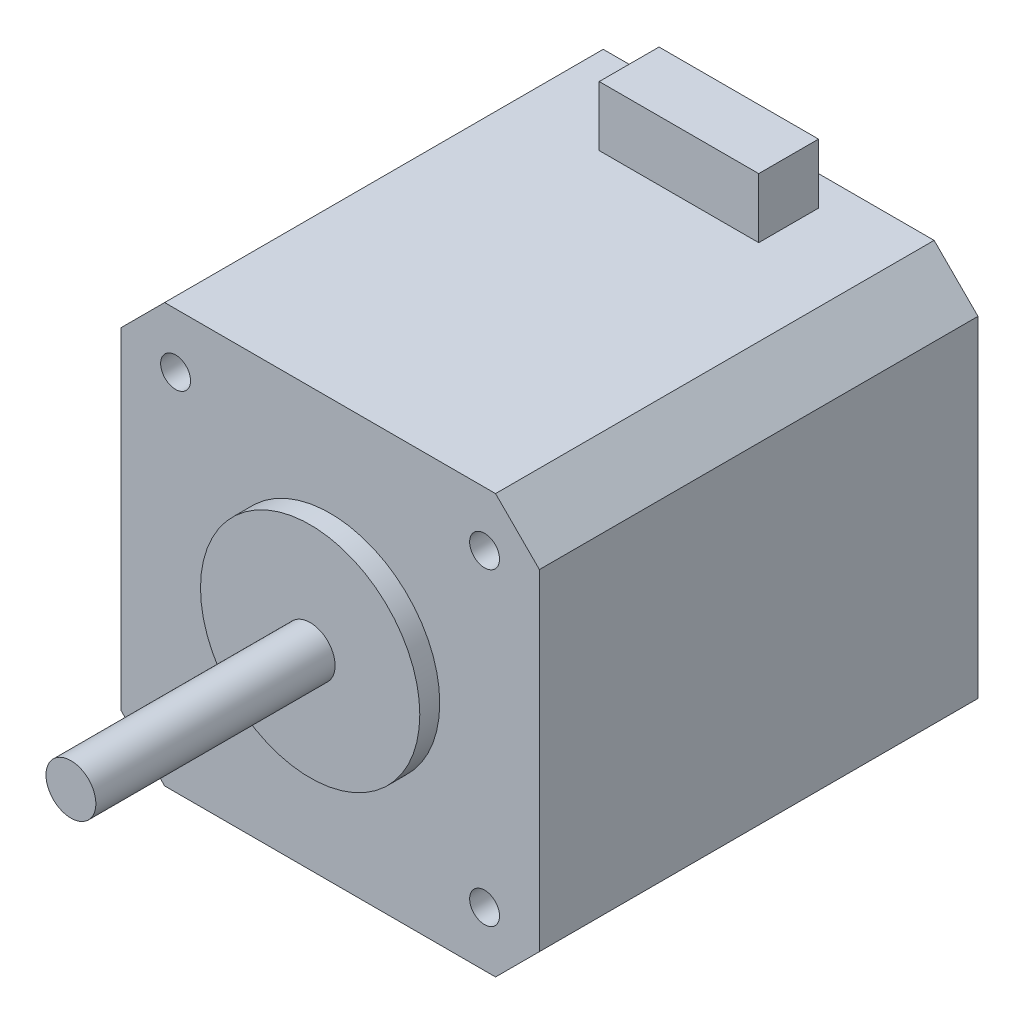
from build123d import *

# Parameters (mm, degrees)
SKETCH_1_R      = 1.5
EXTRUDE_1_DEPTH = 44
SKETCH_2_R      = 11
EXTRUDE_2_DEPTH = 2
SKETCH_3_R      = 2.5
EXTRUDE_3_DEPTH = 26
SKETCH_4_W      = 16
SKETCH_4_H      = 6
EXTRUDE_4_DEPTH = 6


with BuildPart() as part:
    # 草图1 → 凸台-拉伸1 (new body)
    with BuildSketch(Plane.XY):
        Polygon((21, 0), (21, 16.6), (16.6, 21), (0, 21), (-16.6, 21), (-21, 16.6), (-21, 0), (-21, -16.6), (-16.6, -21), (0, -21), (16.6, -21), (21, -16.6), align=None)
        with Locations((15.5, 15.5)):
            Circle(SKETCH_1_R, mode=Mode.SUBTRACT)
        with Locations((15.5, -15.5)):
            Circle(SKETCH_1_R, mode=Mode.SUBTRACT)
        with Locations((-15.5, -15.5)):
            Circle(SKETCH_1_R, mode=Mode.SUBTRACT)
        with Locations((-15.5, 15.5)):
            Circle(SKETCH_1_R, mode=Mode.SUBTRACT)
    extrude(amount=EXTRUDE_1_DEPTH)

    # 草图2 → 凸台-拉伸2 (add)
    with BuildSketch(Plane.XY.offset(44)):
        Circle(SKETCH_2_R)
    extrude(amount=EXTRUDE_2_DEPTH)

    # 草图3 → 凸台-拉伸3 (add)
    with BuildSketch(Plane.XY.offset(44)):
        with Locations(Location((0, 0, 0), (0, 0, 180))):
            Circle(SKETCH_3_R)
    extrude(amount=EXTRUDE_3_DEPTH)

    # 草图4 → 凸台-拉伸4 (add)
    with BuildSketch(Plane(origin=(0, 21, 0), x_dir=(1, 0, 0), z_dir=(0, 1, 0))):
        with Locations((0, -6)):
            Rectangle(SKETCH_4_W, SKETCH_4_H)
    extrude(amount=EXTRUDE_4_DEPTH)


solid = part.part
